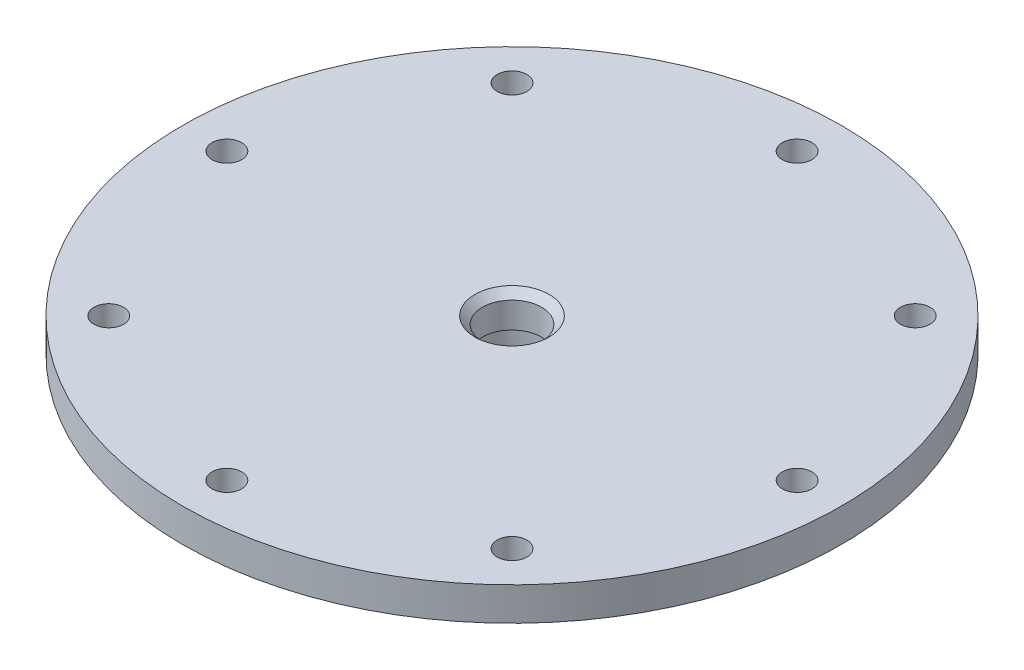
from build123d import *

# Parameters (mm, degrees)
SKETCH_1_R          = 22.25
SKETCH_1_R_2        = 2
EXTRUDE_1_DEPTH     = 2.25
SKETCH_3_R          = 3.65
SKETCH_3_R_2        = 2.5
EXTRUDE_2_DEPTH     = 3
CHAMFER_1_SIZE      = 0.5
SKETCH_4_R          = 1
CUT_EXTRUDE_3_DEPTH = 32.90121471


with BuildPart() as part:
    # Эскиз1 → Вытянуть1 (new body)
    with BuildSketch(Plane(origin=(0, 0, 0), x_dir=(1, 0, 0), z_dir=(0, 1, 0))):
        with Locations(Location((0, 0, 0), (0, 0, 270))):
            Circle(SKETCH_1_R)
        with Locations(Location((0, 0, 0), (0, 0, 270))):
            Circle(SKETCH_1_R_2, mode=Mode.SUBTRACT)
    extrude(amount=EXTRUDE_1_DEPTH)

    # Эскиз3 → Вытянуть2 (add)
    with BuildSketch(Plane.XZ):
        with Locations(Location((0, 0, 0), (0, 0, 90))):
            Circle(SKETCH_3_R)
        with Locations(Location((0, 0, 0), (0, 0, 270))):
            Circle(SKETCH_3_R_2, mode=Mode.SUBTRACT)
    extrude(amount=EXTRUDE_2_DEPTH)

    # Фаска1
    chamfer_1_edges = [part.edges().sort_by_distance(p)[0] for p in [
        (0, 2.25, -2),
    ]]
    chamfer(chamfer_1_edges, length=CHAMFER_1_SIZE)

    # Эскиз4 → Вытянуть3 (cut, through all)
    with BuildSketch(Plane(origin=(0, 2.25, 0), x_dir=(1, 0, 0), z_dir=(0, 1, 0))):
        with Locations(Location((0, 19.25, 0), (0, 0, 270))):
            Circle(SKETCH_4_R)
        with Locations(Location((13.611805538, 13.611805538, 0), (0, 0, 270))):
            Circle(SKETCH_4_R)
        with Locations(Location((19.25, 0, 0), (0, 0, 270))):
            Circle(SKETCH_4_R)
        with Locations(Location((13.611805538, -13.611805538, 0), (0, 0, 270))):
            Circle(SKETCH_4_R)
        with Locations(Location((0, -19.25, 0), (0, 0, 270))):
            Circle(SKETCH_4_R)
        with Locations(Location((-13.611805538, -13.611805538, 0), (0, 0, 270))):
            Circle(SKETCH_4_R)
        with Locations(Location((-19.25, 0, 0), (0, 0, 270))):
            Circle(SKETCH_4_R)
        with Locations(Location((-13.611805538, 13.611805538, 0), (0, 0, 270))):
            Circle(SKETCH_4_R)
    extrude(amount=-CUT_EXTRUDE_3_DEPTH, mode=Mode.SUBTRACT)


solid = part.part
